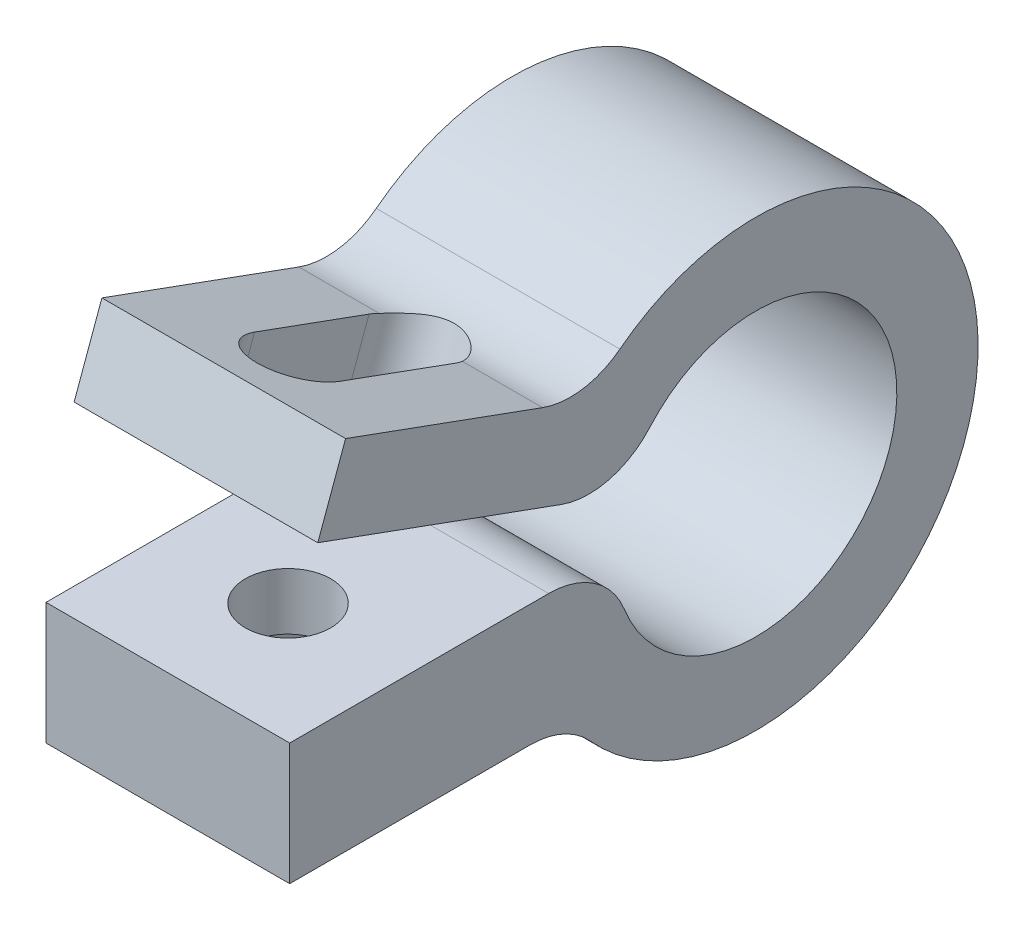
from build123d import *

# Parameters (mm, degrees)
BOSS_EXTRUDE1_DEPTH     = 6
CUT_EXTRUDE1_DEPTH      = 10
CUT_EXTRUDE1_DEPTH_BACK = 2
SKETCH4_R               = 1.05
CUT_EXTRUDE2_DEPTH      = 1.6
SKETCH4_2_R             = 1.05
CUT_EXTRUDE3_DEPTH      = 4


with BuildPart() as part:
    # Sketch1 → Boss-Extrude1 (new body)
    with BuildSketch(Plane(origin=(0, 0, 0), x_dir=(0, 0, -1), z_dir=(1, 0, 0))):
        with BuildLine():
            Line((-11.475, 0), (-5.096628788, 0))
            ThreePointArc((-5.096628788, 0), (-3.969949422, -0.347549212), (-3.234846582, -1.269406393))
            ThreePointArc((-3.234846582, -1.269406393), (3.422206942, -0.603427417), (-2.605598906, 2.299234512))
            ThreePointArc((-2.605598906, 2.299234512), (-3.611663346, 1.6843921), (-4.789264463, 1.743149708))
            Line((-4.789264463, 1.743149708), (-10.782972824, 3.924681145))
            Line((-10.782972824, 3.924681145), (-10.098932537, 5.804066386))
            Line((-10.098932537, 5.804066386), (-5.249850762, 4.039144957))
            ThreePointArc((-5.249850762, 4.039144957), (-4.259008351, 3.942202175), (-3.344188943, 4.334976968))
            ThreePointArc((-3.344188943, 4.334976968), (5.452597189, -0.494781667), (-4.069872513, -3.662207358))
            ThreePointArc((-4.069872513, -3.662207358), (-4.742822691, -3.173037318), (-5.556583933, -3))
            Line((-5.556583933, -3), (-11.475, -3))
            Line((-11.475, -3), (-11.475, -2))
            Line((-11.475, -2), (-11.475, 0))
        make_face()
    extrude(amount=BOSS_EXTRUDE1_DEPTH)

    # Sketch3 → Cut-Extrude1 (cut, two sides: drawn at the far end of the back side and taken through both)
    with BuildSketch(Plane(origin=(0, 1.879385242, -0.684040287), x_dir=(1, 0, 0), z_dir=(0, 0.9396926207859091, -0.34202014332566716)).offset(-CUT_EXTRUDE1_DEPTH_BACK)):
        with BuildLine():
            Line((4.05, -6.550079558), (4.05, -9.550079558))
            ThreePointArc((4.05, -9.550079558), (3, -10.600079558), (1.95, -9.550079558))
            Line((1.95, -9.550079558), (1.95, -6.550079558))
            ThreePointArc((1.95, -6.550079558), (3, -5.500079558), (4.05, -6.550079558))
        make_face()
    extrude(amount=CUT_EXTRUDE1_DEPTH + CUT_EXTRUDE1_DEPTH_BACK, mode=Mode.SUBTRACT)

    # Sketch4 → Cut-Extrude2 (cut)
    with BuildSketch(Plane.XZ.offset(3)):
        Polygon((4.154700538, 10.515791966), (1.845299462, 10.515791966), (0.690598923, 8.515791966), (1.845299462, 6.515791966), (4.154700538, 6.515791966), (5.309401077, 8.515791966), align=None)
        with Locations((3, 8.515791966)):
            Circle(SKETCH4_R, mode=Mode.SUBTRACT)
    extrude(amount=-CUT_EXTRUDE2_DEPTH, mode=Mode.SUBTRACT)

    # Sketch4<2> → Cut-Extrude3 (cut)
    with BuildSketch(Plane.XZ.offset(3)):
        with Locations((3, 8.515791966)):
            Circle(SKETCH4_2_R)
    extrude(amount=-CUT_EXTRUDE3_DEPTH, mode=Mode.SUBTRACT)


solid = part.part
